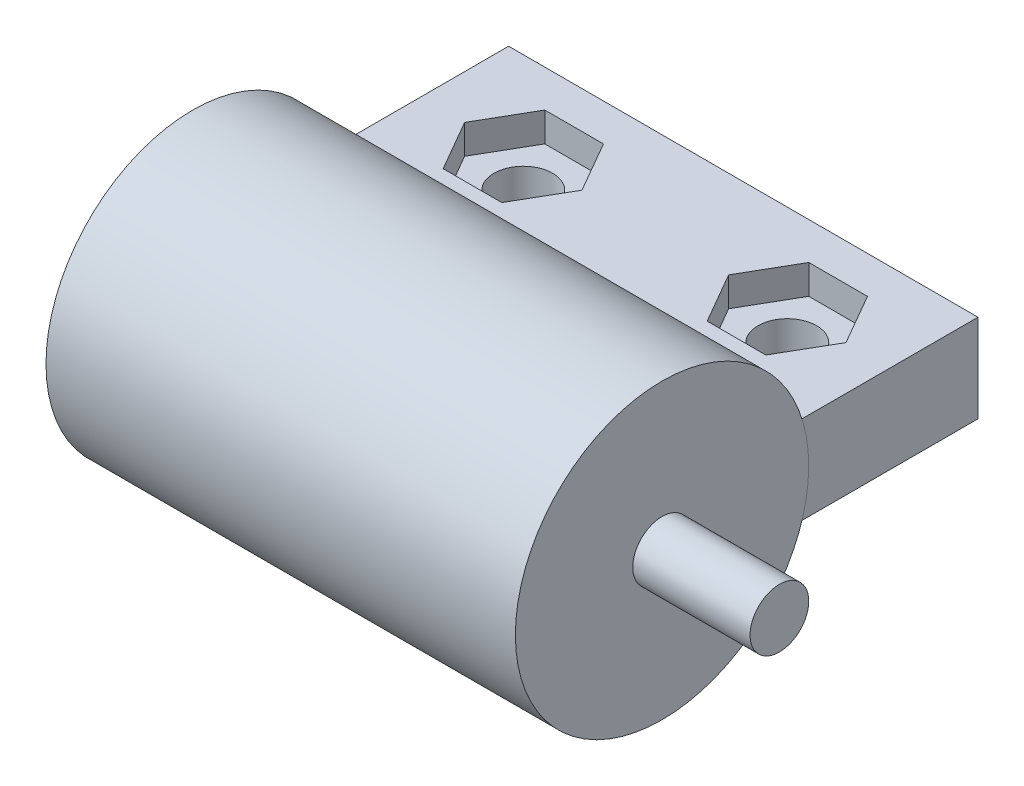
from build123d import *

# Parameters (mm, degrees)
SKETCH_1_W      = 8
SKETCH_1_H      = 3
SKETCH_1_R      = 0.5
EXTRUDE_1_DEPTH = 1
SKETCH_2_W      = 8
SKETCH_2_H      = 3
EXTRUDE_2_DEPTH = 0.5
SKETCH_3_R      = 2.5
EXTRUDE_3_DEPTH = 8
SKETCH_6_R      = 0.5
EXTRUDE_4_DEPTH = 2


with BuildPart() as part:
    # 草图1 → 凸台-拉伸1 (new body)
    with BuildSketch(Plane(origin=(0, 0, 0), x_dir=(1, 0, 0), z_dir=(0, 1, 0))):
        with Locations((4, 1.5)):
            Rectangle(SKETCH_1_W, SKETCH_1_H)
        with Locations(Location((1.75, 1.5, 0), (0, 0, 270))):
            Circle(SKETCH_1_R, mode=Mode.SUBTRACT)
        with Locations(Location((6.25, 1.5, 0), (0, 0, 270))):
            Circle(SKETCH_1_R, mode=Mode.SUBTRACT)
    extrude(amount=EXTRUDE_1_DEPTH)

    # 草图2 → 凸台-拉伸2 (add)
    with BuildSketch(Plane(origin=(0, 1, 0), x_dir=(1, 0, 0), z_dir=(0, 1, 0))):
        with Locations((4, 1.5)):
            Rectangle(SKETCH_2_W, SKETCH_2_H)
        Polygon((2.25, 0.633974596), (1.25, 0.633974596), (0.75, 1.5), (1.25, 2.366025404), (2.25, 2.366025404), (2.75, 1.5), align=None, mode=Mode.SUBTRACT)
        Polygon((5.75, 2.366025404), (5.25, 1.5), (5.75, 0.633974596), (6.75, 0.633974596), (7.25, 1.5), (6.75, 2.366025404), align=None, mode=Mode.SUBTRACT)
    extrude(amount=EXTRUDE_2_DEPTH)


with BuildPart() as body_2:
    # 草图3 → 凸台-拉伸3 (new body)
    with BuildSketch(Plane(origin=(8, 0, 0), x_dir=(0, 0, -1), z_dir=(1, 0, 0))):
        with Locations((-2.384848004, 0.75)):
            Circle(SKETCH_3_R)
    extrude(amount=-EXTRUDE_3_DEPTH)

    # 草图6 → 凸台-拉伸4 (add)
    with BuildSketch(Plane(origin=(8, 0, 0), x_dir=(0, 0, -1), z_dir=(1, 0, 0))):
        with Locations((-2.384848004, 0.75)):
            Circle(SKETCH_6_R)
    extrude(amount=EXTRUDE_4_DEPTH)


solid = Compound([part.part, body_2.part])
